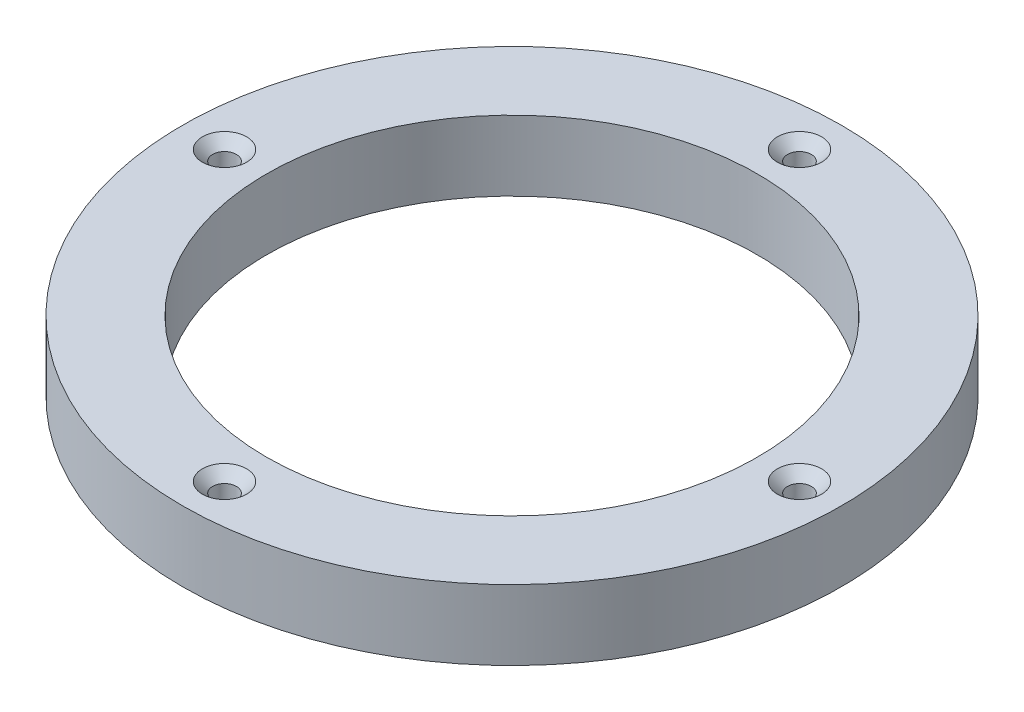
from build123d import *

# Parameters (mm, degrees)
SCHIZZO1_R                             = 47
SCHIZZO1_R_2                           = 35
ESTRUSIONE_ESTRUSIONE1_DEPTH           = 10
FORO_SVASATO_PER_VITE_M3_1_D           = 3.4
FORO_SVASATO_PER_VITE_M3_1_DEPTH       = 188
FORO_SVASATO_PER_VITE_M3_1_CSINK_D     = 6.3
FORO_SVASATO_PER_VITE_M3_1_CSINK_ANGLE = 90
FORO_SVASATO_PER_VITE_M3_1_TIP         = 1.021463052


with BuildPart() as part:
    # Schizzo1 → Estrusione-Estrusione1 (new body)
    with BuildSketch(Plane(origin=(0, 0, 0), x_dir=(1, 0, 0), z_dir=(0, 1, 0))):
        with Locations(Location((0, 0, 0), (0, 0, 270))):
            Circle(SCHIZZO1_R)
        with Locations(Location((0, 0, 0), (0, 0, 270))):
            Circle(SCHIZZO1_R_2, mode=Mode.SUBTRACT)
    extrude(amount=ESTRUSIONE_ESTRUSIONE1_DEPTH)

    # Foro svasato per Vite M3-1
    with Locations(Plane(origin=(-41, 10, 0), x_dir=(0, 0, 1), z_dir=(0, 1, 0))):
        with Locations((0, 0), (0, 82), (41, 41), (-41, 41)):
            CounterSinkHole(FORO_SVASATO_PER_VITE_M3_1_D / 2, FORO_SVASATO_PER_VITE_M3_1_CSINK_D / 2, depth=FORO_SVASATO_PER_VITE_M3_1_DEPTH, counter_sink_angle=FORO_SVASATO_PER_VITE_M3_1_CSINK_ANGLE)
            with Locations((0, 0, -(FORO_SVASATO_PER_VITE_M3_1_DEPTH + FORO_SVASATO_PER_VITE_M3_1_TIP / 2))):  # 118° drill point
                Cone(0, FORO_SVASATO_PER_VITE_M3_1_D / 2, FORO_SVASATO_PER_VITE_M3_1_TIP, mode=Mode.SUBTRACT)


solid = part.part
